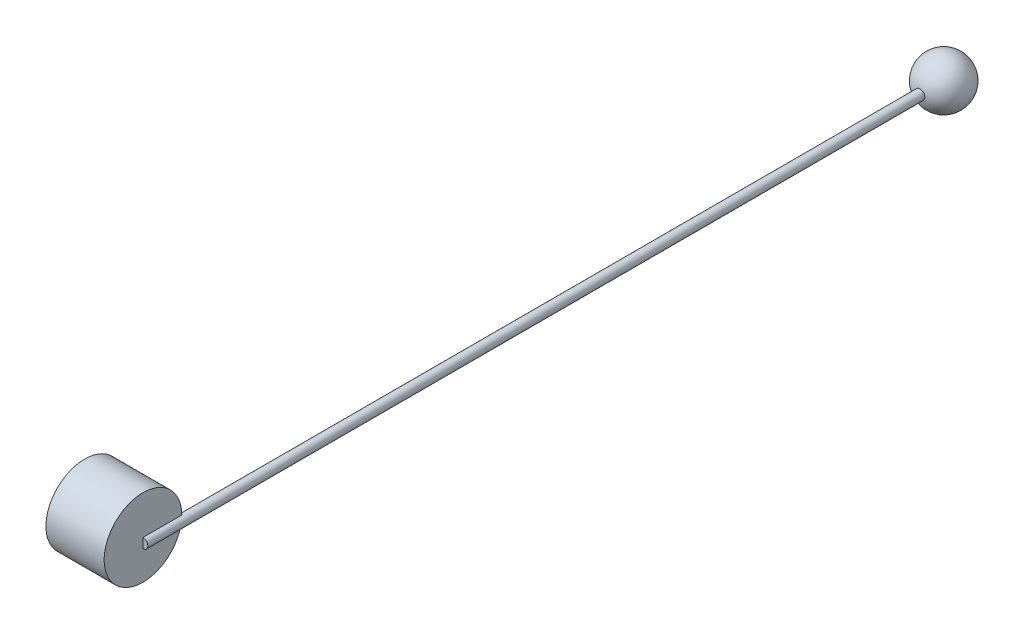
from build123d import *

# Parameters (mm, degrees)
RESSALTO_EXTRUS_O1_REACH      = 87.073
RESSALTO_EXTRUS_O1_END_RADIUS = 2.5
ESBO_O4_R                     = 0.5
SMLINK_PSI_CIRCLE_R           = 4
SMLINK_PSI_CYLINDER_DEPTH     = 6


with BuildPart() as part:
    # Esboço3 → Revolução1 (revolve)
    with BuildSketch(Plane(origin=(0, 0, 0), x_dir=(-1, 0, 0), z_dir=(0, 1, 0))):
        with BuildLine():
            Line((0, -80), (0, -85))
            ThreePointArc((0, -85), (2.5, -82.5), (0, -80))
        make_face()
    revolve(axis=Axis((0, 0, -80), (0, 0, -1)))

    # Ressalto-extrusão1: up to this sphere (the profile starts outside it)
    ressalto_extrus_o1_end = Location((0, 0, -82.5)) * Sphere(RESSALTO_EXTRUS_O1_END_RADIUS, mode=Mode.PRIVATE)
    # Esboço4 → Ressalto-extrusão1 (add, up to the surface)
    with BuildSketch(Plane(origin=(0, 0, 0), x_dir=(0, 1, 0), z_dir=(0, 0, 1)), mode=Mode.PRIVATE) as ressalto_extrus_o1_sk1:
        with Locations(Location((0, 0, 0), (0, 0, 270))):
            Circle(ESBO_O4_R)
    ressalto_extrus_o1_tool1 = extrude(ressalto_extrus_o1_sk1.sketch, amount=-RESSALTO_EXTRUS_O1_REACH, mode=Mode.PRIVATE) - ressalto_extrus_o1_end
    add(ressalto_extrus_o1_tool1.solids().sort_by_distance((0, 0, 0))[0])


with BuildPart() as body_2:
    # SMLINK_PSI_CIRCLE → SMLINK_PSI_CYLINDER (new body)
    with BuildSketch(Plane(origin=(0, 0, 0), x_dir=(0, 0, -1), z_dir=(1, 0, 0))):
        with Locations((0, 0.5)):
            Circle(SMLINK_PSI_CIRCLE_R)
    extrude(amount=-SMLINK_PSI_CYLINDER_DEPTH)


solid = Compound([part.part, body_2.part])
